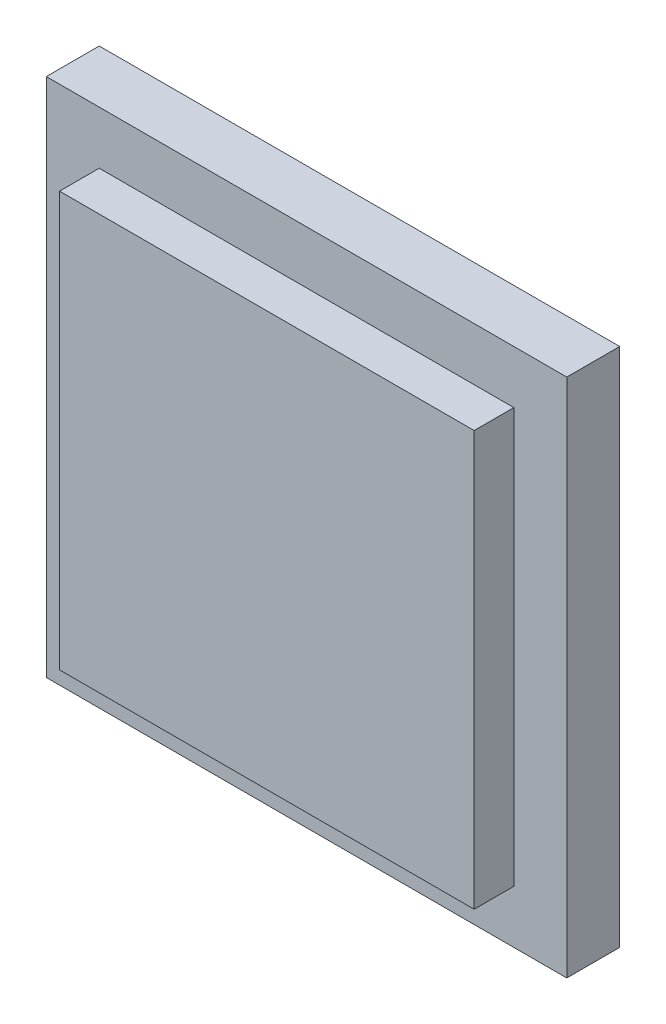
from build123d import *

# Parameters (mm, degrees)
ESQUISSE1_W        = 59
ESQUISSE1_H        = 59
BOSS_EXTRU_1_DEPTH = 6
ESQUISSE2_W        = 47
ESQUISSE2_H        = 47
BOSS_EXTRU_2_DEPTH = 4.5


with BuildPart() as part:
    # Esquisse1 → Boss.-Extru.1 (new body)
    with BuildSketch(Plane.XY):
        Rectangle(ESQUISSE1_W, ESQUISSE1_H)
    extrude(amount=BOSS_EXTRU_1_DEPTH)

    # Esquisse2 → Boss.-Extru.2 (add)
    with BuildSketch(Plane.XY.offset(6)):
        Rectangle(ESQUISSE2_W, ESQUISSE2_H)
    extrude(amount=BOSS_EXTRU_2_DEPTH)


solid = part.part
